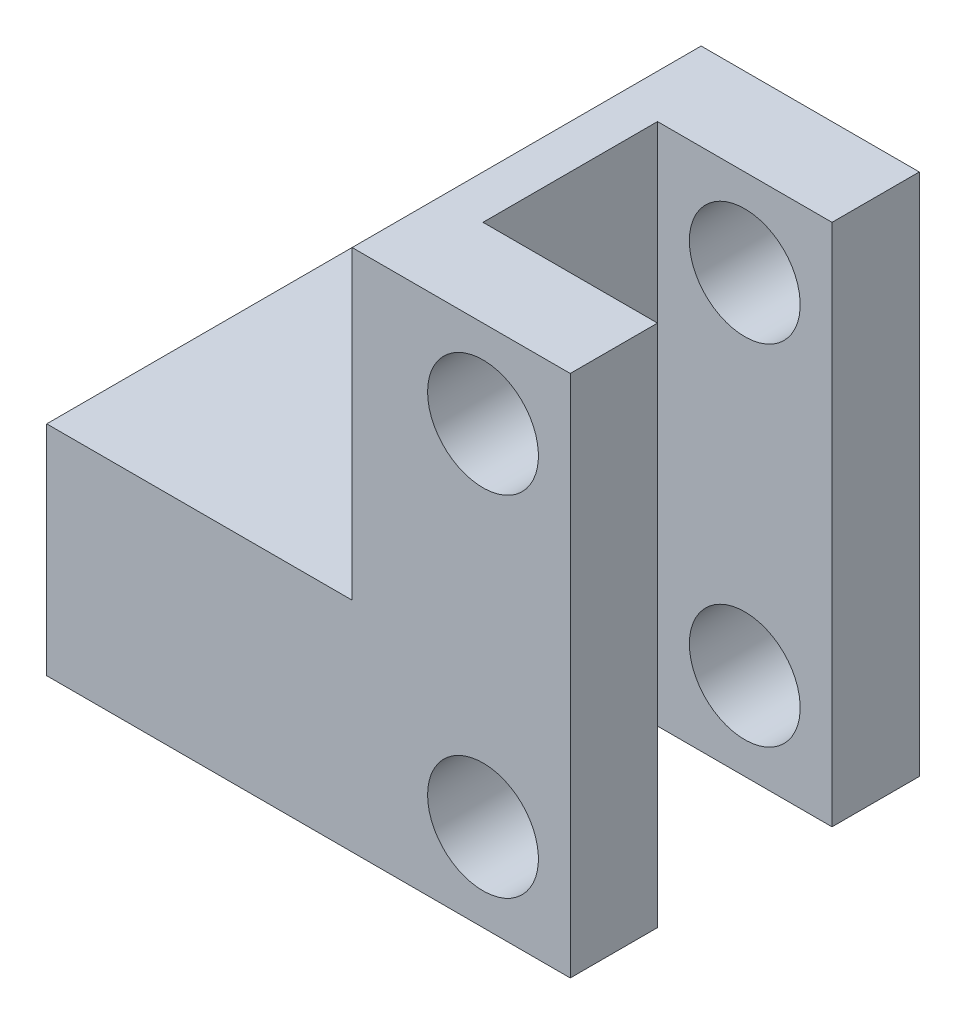
from build123d import *

# Parameters (mm, degrees)
SKETCH1_W                = 60
SKETCH1_H                = 60
BOSS_EXTRUDE1_DEPTH      = 10
SKETCH2_W                = 40
SKETCH2_H                = 35
CUT_EXTRUDE1_DEPTH       = 40
BOSS_EXTRUDE8_DEPTH      = 20
BOSS_EXTRUDE8_DEPTH_BACK = 10
BOSS_EXTRUDE9_DEPTH      = 10
SKETCH3_R                = 6.35
CUT_EXTRUDE2_DEPTH       = 40


with BuildPart() as part:
    # Sketch1 → Boss-Extrude1 (new body)
    with BuildSketch(Plane.XY):
        Rectangle(SKETCH1_W, SKETCH1_H)
    extrude(amount=BOSS_EXTRUDE1_DEPTH)

    # Sketch2 → Cut-Extrude1 (cut)
    with BuildSketch(Plane.XY.offset(10)):
        with Locations((-10, 12.5)):
            Rectangle(SKETCH2_W, SKETCH2_H)
    extrude(amount=-CUT_EXTRUDE1_DEPTH, mode=Mode.SUBTRACT)

    # Sketch6 → Boss-Extrude8 (add, two sides: drawn at the far end of the back side and taken through both)
    with BuildSketch(Plane(origin=(0, 0, 0), x_dir=(-1, 0, 0), z_dir=(0, 0, -1)).offset(-BOSS_EXTRUDE8_DEPTH_BACK)):
        Polygon((-10, 30), (-5, 30), (-5, -5), (30, -5), (30, -30), (-10, -30), align=None)
    extrude(amount=BOSS_EXTRUDE8_DEPTH + BOSS_EXTRUDE8_DEPTH_BACK)

    # Sketch7 → Boss-Extrude9 (add)
    with BuildSketch(Plane(origin=(0, 0, -20), x_dir=(-1, 0, 0), z_dir=(0, 0, -1))):
        Polygon((-30, 30), (-5, 30), (-5, -5), (30, -5), (30, -30), (-30, -30), align=None)
    extrude(amount=BOSS_EXTRUDE9_DEPTH)

    # Sketch3 → Cut-Extrude2 (cut, symmetric)
    with BuildSketch(Plane.XY.offset(10)):
        with Locations(Location((20, -20, 0), (0, 0, 180))):
            Circle(SKETCH3_R)
        with Locations(Location((20, 20, 0), (0, 0, 180))):
            Circle(SKETCH3_R)
    extrude(amount=CUT_EXTRUDE2_DEPTH, both=True, mode=Mode.SUBTRACT)


solid = part.part
